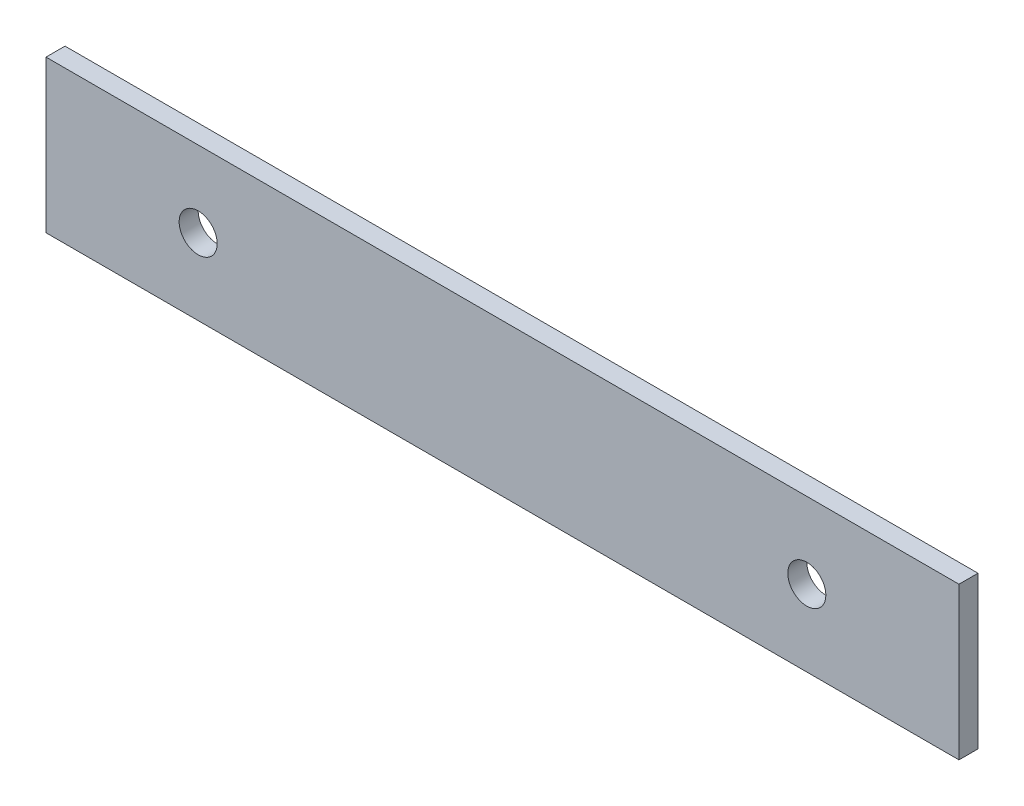
from build123d import *

# Parameters (mm, degrees)
SKETCH1_W           = 152.4
SKETCH1_H           = 25.4
SKETCH1_R           = 3.175
BOSS_EXTRUDE1_DEPTH = 3.175


with BuildPart() as part:
    # Sketch1 → Boss-Extrude1 (new body)
    with BuildSketch(Plane.XY):
        Rectangle(SKETCH1_W, SKETCH1_H)
        with Locations((50.8, 0)):
            Circle(SKETCH1_R, mode=Mode.SUBTRACT)
        with Locations(Location((-50.8, 0, 0), (0, 0, 180))):
            Circle(SKETCH1_R, mode=Mode.SUBTRACT)
    extrude(amount=BOSS_EXTRUDE1_DEPTH)


solid = part.part
